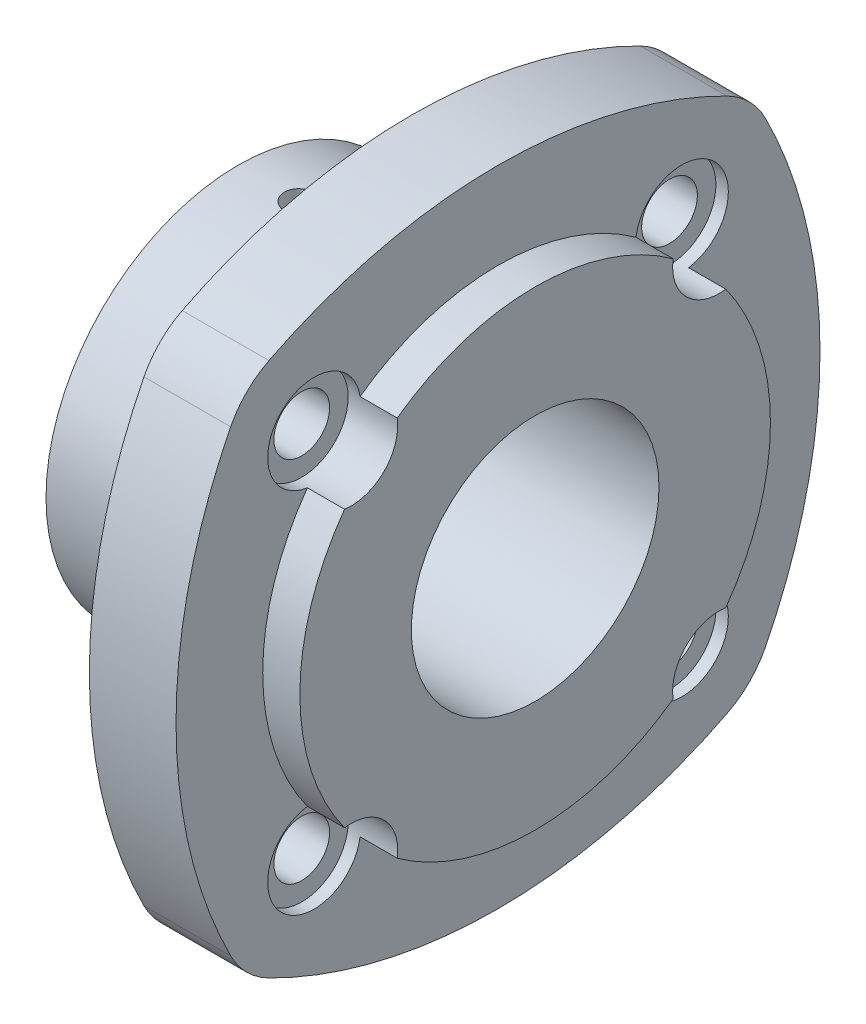
from build123d import *

# Parameters (mm, degrees)
EXTRUDE_1_DEPTH              = 14
SKETCH_2_R                   = 38
EXTRUDE_2_DEPTH              = 6
SKETCH_3_R                   = 31
EXTRUDE_3_DEPTH              = 28
SKETCH_4_R                   = 20
CUT_EXTRUDE_4_DEPTH          = 88.8179936
SKETCH_5_R                   = 2.5
CUT_EXTRUDE_5_DEPTH          = 79.689262292
HOLE_WIZARD_M8_1_D           = 9
HOLE_WIZARD_M8_1_CBORE_D     = 15
HOLE_WIZARD_M8_1_CBORE_DEPTH = 8
FILLET_1_R                   = 14


with BuildPart() as part:
    # 草圖1 → 伸長1 (new body)
    with BuildSketch(Plane(origin=(0, 0, 0), x_dir=(0, 0, -1), z_dir=(1, 0, 0))):
        with BuildLine():
            ThreePointArc((41.00892786, 41.00892786), (0, 52), (-41.00892786, 41.00892786))
            ThreePointArc((-41.00892786, 41.00892786), (-52, 0), (-41.00892786, -41.00892786))
            ThreePointArc((-41.00892786, -41.00892786), (0, -52), (41.00892786, -41.00892786))
            ThreePointArc((41.00892786, -41.00892786), (52, 0), (41.00892786, 41.00892786))
        make_face()
    extrude(amount=EXTRUDE_1_DEPTH)

    # 草圖2 → 伸長2 (add)
    with BuildSketch(Plane(origin=(14, 0, 0), x_dir=(0, 0, -1), z_dir=(1, 0, 0))):
        Circle(SKETCH_2_R)
    extrude(amount=EXTRUDE_2_DEPTH)

    # 草圖3 → 伸長3 (add)
    with BuildSketch(Plane.ZY):
        with Locations(Location((0, 0, 0), (0, 0, 180))):
            Circle(SKETCH_3_R)
    extrude(amount=EXTRUDE_3_DEPTH)

    # 草圖4 → 伸長4 (cut, through all)
    with BuildSketch(Plane(origin=(20, 0, 0), x_dir=(0, 0, -1), z_dir=(1, 0, 0))):
        Circle(SKETCH_4_R)
    extrude(amount=-CUT_EXTRUDE_4_DEPTH, mode=Mode.SUBTRACT)

    # 草圖5 → 伸長5 (cut, through all)
    with BuildSketch(Plane(origin=(0, 0, 0), x_dir=(1, 0, 0), z_dir=(0, 1, 0))):
        with Locations(Location((-18, 0, 0), (0, 0, 90))):
            Circle(SKETCH_5_R)
    extrude(amount=CUT_EXTRUDE_5_DEPTH, mode=Mode.SUBTRACT)

    # M8 六角承窩頭蓋螺釘的柱孔1 (through all)
    with Locations(Plane(origin=(20, 0, 0), x_dir=(0, 0, -1), z_dir=(1, 0, 0))):
        with Locations((29.69848481, 29.69848481), (29.69848481, -29.69848481), (-29.69848481, 29.69848481), (-29.69848481, -29.69848481)):
            CounterBoreHole(HOLE_WIZARD_M8_1_D / 2, HOLE_WIZARD_M8_1_CBORE_D / 2, HOLE_WIZARD_M8_1_CBORE_DEPTH)

    # 圓角1
    fillet_1_edges = [part.edges().sort_by_distance(p)[0] for p in [
        (7, 41.00892786, 41.00892786),
        (7, 41.00892786, -41.00892786),
        (7, -41.00892786, -41.00892786),
        (7, -41.00892786, 41.00892786),
    ]]
    fillet(fillet_1_edges, radius=FILLET_1_R)


solid = part.part
